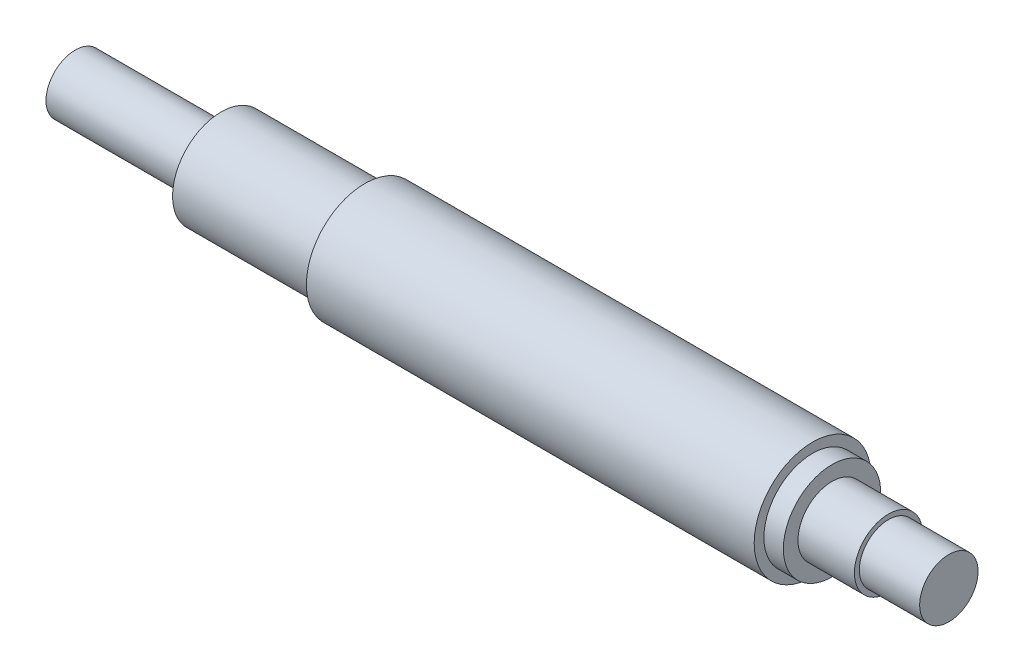
from build123d import *

# Parameters (mm, degrees)
BOSS_EXTRUDE2_START = 5
SKETCH6_R           = 3
BOSS_EXTRUDE2_DEPTH = 5


with BuildPart() as part:
    # Sketch2 → Revolve1 (revolve)
    with BuildSketch(Plane.XY, mode=Mode.PRIVATE) as revolve1_sk:
        Polygon((-42.375, 0), (42.375, 0), (42.375, 3), (36.175, 3), (36.175, 3.5), (30.375, 3.5), (30.375, 5), (28.375, 5), (28.375, 6), (-17.625, 6), (-17.625, 5), (-32.375, 5), (-32.375, 3), (-42.375, 3), align=None)
    revolve(revolve1_sk.sketch.rotate(Axis((-42.375, 0, 0), (1, 0, 0)), 90), axis=Axis((-42.375, 0, 0), (1, 0, 0)))

    # Sketch6 → Boss-Extrude2 (add)
    with BuildSketch(Plane.ZY.offset(42.375).offset(BOSS_EXTRUDE2_START)):
        Circle(SKETCH6_R)
    extrude(amount=-BOSS_EXTRUDE2_DEPTH)


solid = part.part
